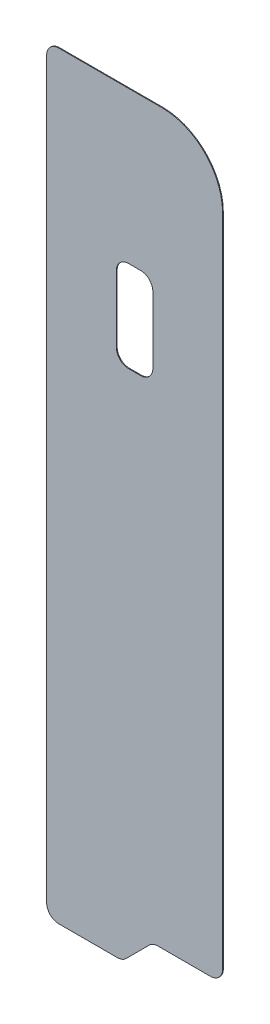
from build123d import *

# Parameters (mm, degrees)
BOSS_EXTRUDE6_DEPTH = 0.125
BOSS_EXTRUDE7_DEPTH = 0.125
CUT_EXTRUDE2_DEPTH  = 67.597789941


with BuildPart() as part:
    # Sketch9 → Boss-Extrude6 (new body)
    with BuildSketch(Plane.XY):
        with BuildLine():
            Line((-12.5, 60), (4.5, 60))
            ThreePointArc((4.5, 60), (11.571067812, 57.071067812), (14.5, 50))
            Line((14.5, 50), (14.5, -58))
            ThreePointArc((14.5, -58), (13.914213562, -59.414213562), (12.5, -60))
            Line((12.5, -60), (-12.5, -60))
            ThreePointArc((-12.5, -60), (-13.914213562, -59.414213562), (-14.5, -58))
            Line((-14.5, -58), (-14.5, 58))
            ThreePointArc((-14.5, 58), (-13.914213562, 59.414213562), (-12.5, 60))
        make_face()
    extrude(amount=BOSS_EXTRUDE6_DEPTH)

    # Sketch10 → Boss-Extrude7 (add)
    with BuildSketch(Plane(origin=(0, 0, 0), x_dir=(-1, 0, 0), z_dir=(0, 0, -1))):
        with BuildLine():
            Line((14.5, -58), (14.5, -63))
            ThreePointArc((14.5, -63), (13.914213562, -64.414213562), (12.5, -65))
            Line((12.5, -65), (2.828427125, -65))
            ThreePointArc((2.828427125, -65), (2.06306026, -64.847759065), (1.414213562, -64.414213562))
            Line((1.414213562, -64.414213562), (-2.414213562, -60.585786438))
            ThreePointArc((-2.414213562, -60.585786438), (-3.06306026, -60.152240935), (-3.828427125, -60))
            Line((-3.828427125, -60), (-12.5, -60))
            Line((-12.5, -60), (-12.5, -58))
            Line((-12.5, -58), (14.5, -58))
        make_face()
    extrude(amount=-BOSS_EXTRUDE7_DEPTH)

    # Sketch11 → Cut-Extrude2 (cut, through all)
    with BuildSketch(Plane.XY.offset(0.125)):
        with BuildLine():
            Line((-1, 20), (1, 20))
            ThreePointArc((1, 20), (2.414213562, 20.585786438), (3, 22))
            Line((3, 22), (3, 33))
            ThreePointArc((3, 33), (2.414213562, 34.414213562), (1, 35))
            Line((1, 35), (-1, 35))
            ThreePointArc((-1, 35), (-2.414213562, 34.414213562), (-3, 33))
            Line((-3, 33), (-3, 22))
            ThreePointArc((-3, 22), (-2.414213562, 20.585786438), (-1, 20))
        make_face()
    extrude(amount=-CUT_EXTRUDE2_DEPTH, mode=Mode.SUBTRACT)


solid = part.part
